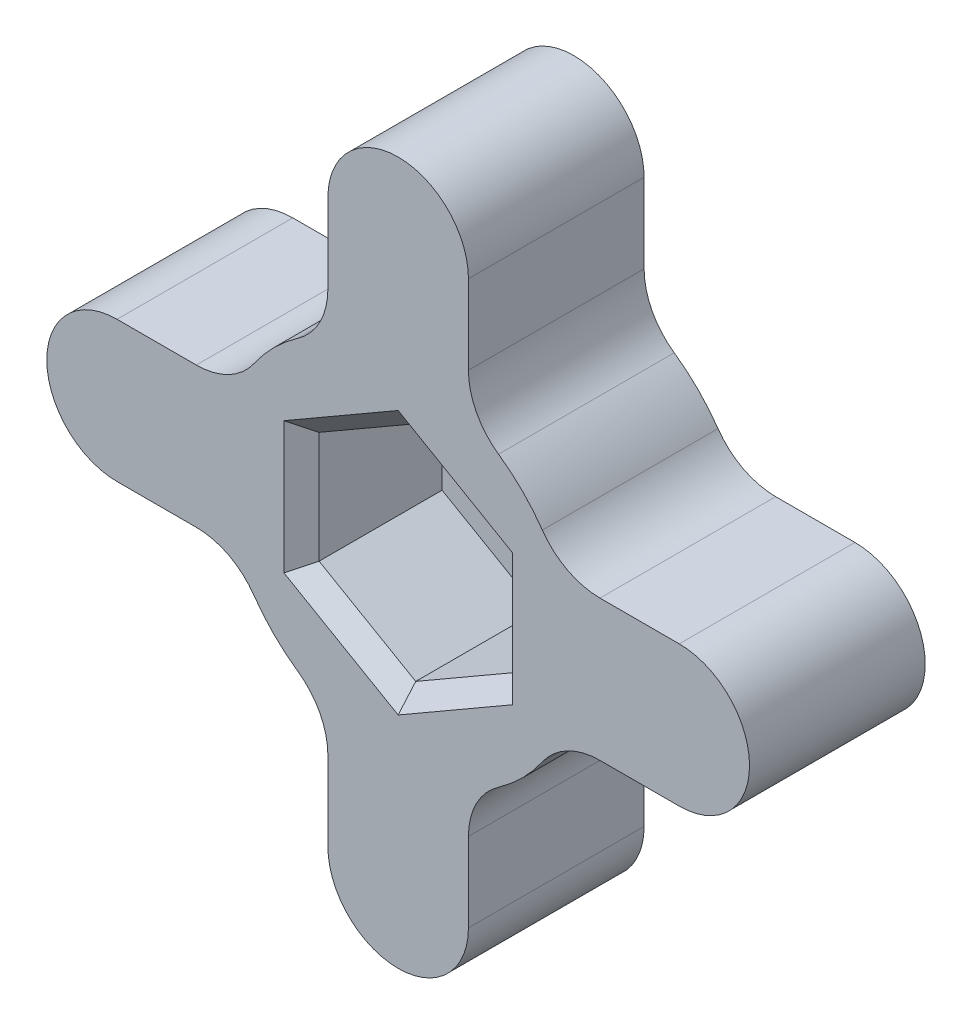
from build123d import *

# Parameters (mm, degrees)
ESBO_O1_R                = 5
RESSALTO_EXTRUS_O1_DEPTH = 5
CORTE_EXTRUS_O1_DEPTH    = 4
ESBO_O3_R                = 2
CORTE_EXTRUS_O2_DEPTH    = 9.124038405
RESSALTO_EXTRUS_O2_DEPTH = 5
CHANFRO1_SIZE            = 0.5
FILETE1_R                = 2


with BuildPart() as part:
    # Esboço1 → Ressalto-extrusão1 (new body)
    with BuildSketch(Plane.XY):
        Circle(ESBO_O1_R)
    extrude(amount=RESSALTO_EXTRUS_O1_DEPTH)

    # Esboço2 → Corte-extrusão1 (cut)
    with BuildSketch(Plane.XY.offset(5)):
        Polygon((0, 3.175426481), (-2.75, 1.58771324), (-2.75, -1.58771324), (0, -3.175426481), (2.75, -1.58771324), (2.75, 1.58771324), align=None)
    extrude(amount=-CORTE_EXTRUS_O1_DEPTH, mode=Mode.SUBTRACT)

    # Esboço3 → Corte-extrusão2 (cut, through all)
    with BuildSketch(Plane.XY.offset(1)):
        Circle(ESBO_O3_R)
    extrude(amount=-CORTE_EXTRUS_O2_DEPTH, mode=Mode.SUBTRACT)

    # Esboço4 → Ressalto-extrusão2 (add, through all)
    with BuildSketch(Plane(origin=(0, 0, 0), x_dir=(-1, 0, 0), z_dir=(0, 0, -1))):
        with BuildLine():
            Line((-4.582575695, 2), (-8, 2))
            ThreePointArc((-8, 2), (-10, 1.13e-07), (-8.000000226, -2))
            Line((-8.000000226, -2), (-4.582575695, -2))
            ThreePointArc((-4.582575695, -2), (-5, 0), (-4.582575695, 2))
        make_face()
        with BuildLine():
            Line((2, 4.582575695), (2, 8))
            ThreePointArc((2, 8), (1.13e-07, 10), (-2, 8.000000226))
            Line((-2, 8.000000226), (-2, 4.582575695))
            ThreePointArc((-2, 4.582575695), (0, 5), (2, 4.582575695))
        make_face()
        with BuildLine():
            Line((4.582575695, -2), (8, -2))
            ThreePointArc((8, -2), (10, -1.13e-07), (8.000000226, 2))
            Line((8.000000226, 2), (4.582575695, 2))
            ThreePointArc((4.582575695, 2), (5, 0), (4.582575695, -2))
        make_face()
        with BuildLine():
            Line((-2, -4.582575695), (-2, -8))
            ThreePointArc((-2, -8), (-1.13e-07, -10), (2, -8.000000226))
            Line((2, -8.000000226), (2, -4.582575695))
            ThreePointArc((2, -4.582575695), (0, -5), (-2, -4.582575695))
        make_face()
    extrude(amount=-RESSALTO_EXTRUS_O2_DEPTH)

    # Chanfro1
    chanfro1_edges = [part.edges().sort_by_distance(p)[0] for p in [
        (1.375, 2.38156986, 5),
        (-1.375, 2.38156986, 5),
        (-2.75, 0, 5),
        (-1.375, -2.38156986, 5),
        (1.375, -2.38156986, 5),
        (2.75, 0, 5),
    ]]
    chamfer(chanfro1_edges, length=CHANFRO1_SIZE)

    # Filete1
    filete1_edges = [part.edges().sort_by_distance(p)[0] for p in [
        (4.582575695, 2, 2.5),
        (4.582575695, -2, 2.5),
        (-2, 4.582575695, 2.5),
        (2, 4.582575695, 2.5),
        (-4.582575695, -2, 2.5),
        (-4.582575695, 2, 2.5),
        (2, -4.582575695, 2.5),
        (-2, -4.582575695, 2.5),
    ]]
    fillet(filete1_edges, radius=FILETE1_R)


solid = part.part
